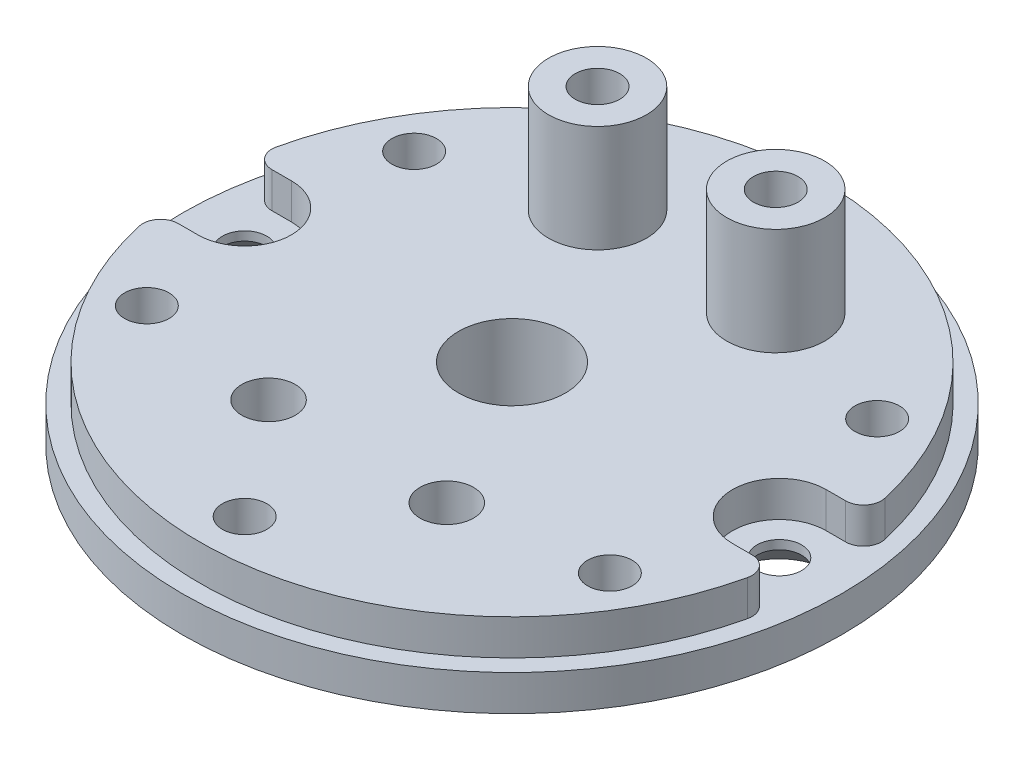
from build123d import *

# Parameters (mm, degrees)
SKETCH1_R            = 18.5
BOSS_EXTRUDE1_DEPTH  = 2
SKETCH2_R            = 17.5
BOSS_EXTRUDE2_DEPTH  = 2
SKETCH3_R            = 6
BOSS_EXTRUDE3_DEPTH  = 5
CUT_EXTRUDE1_REACH   = 29.668
SKETCH4_R            = 3
CUT_EXTRUDE4_DEPTH   = 2
FILLET1_R            = 1
CUT_EXTRUDE5_REACH   = 29.083
SKETCH6_R            = 1.25
FILLET1_OF_MIRROR1_R = 1
CHAMFER1_SIZE        = 1.5
CUT_EXTRUDE6_REACH   = 28.636
SKETCH7_R            = 1.25
CIRPATTERN1_COUNT    = 6
SKETCH9_R            = 1.5
CUT_EXTRUDE7_DEPTH   = 3.5
SKETCH10_R           = 2.75
BOSS_EXTRUDE4_DEPTH  = 6
SKETCH11_R           = 1.25
CUT_EXTRUDE8_DEPTH   = 6
FILLET2_R            = 0.25
CHAMFER2_SIZE        = 0.5
CUT_EXTRUDE9_DEPTH   = 0.3
CIRPATTERN2_COUNT    = 4
CHAMFER3_SIZE        = 0.25


with BuildPart() as part:
    # Sketch1 → Boss-Extrude1 (new body)
    with BuildSketch(Plane(origin=(0, 0, 0), x_dir=(1, 0, 0), z_dir=(0, 1, 0))):
        with Locations(Location((0, 0, 0), (0, 0, 270))):
            Circle(SKETCH1_R)
    extrude(amount=BOSS_EXTRUDE1_DEPTH)

    # Sketch2 → Boss-Extrude2 (add)
    with BuildSketch(Plane(origin=(0, 2, 0), x_dir=(1, 0, 0), z_dir=(0, 1, 0))):
        with Locations(Location((0, 0, 0), (0, 0, 270))):
            Circle(SKETCH2_R)
    extrude(amount=BOSS_EXTRUDE2_DEPTH)

    # Sketch3 → Boss-Extrude3 (add)
    with BuildSketch(Plane.XZ):
        with Locations(Location((0, 0, 0), (0, 0, 90))):
            Circle(SKETCH3_R)
    extrude(amount=BOSS_EXTRUDE3_DEPTH)

    # Sketch4 → Cut-Extrude1 (cut, up to next)
    with BuildSketch(Plane.XZ.offset(5), mode=Mode.PRIVATE) as cut_extrude1_sk1:
        with Locations(Location((0, 0, 0), (0, 0, 270))):
            Circle(SKETCH4_R)
    cut_extrude1_tool1 = extrude(cut_extrude1_sk1.sketch, amount=-CUT_EXTRUDE1_REACH, mode=Mode.PRIVATE) & part.part
    add(cut_extrude1_tool1.solids().sort_by_distance((0, -5, 0))[0], mode=Mode.SUBTRACT)

    # Sketch5 → Cut-Extrude4 (cut)
    with BuildSketch(Plane(origin=(0, 4, 0), x_dir=(1, 0, 0), z_dir=(0, 1, 0))):
        with BuildLine():
            Line((-17.625, 2.625), (-17.625, -2.625))
            Line((-17.625, -2.625), (-15, -2.625))
            ThreePointArc((-15, -2.625), (-12.375, 0), (-15, 2.625))
            Line((-15, 2.625), (-17.625, 2.625))
        make_face()
    cut_extrude4 = extrude(amount=-CUT_EXTRUDE4_DEPTH, mode=Mode.SUBTRACT)

    # Fillet1
    fillet1_edges = [part.edges().sort_by_distance(p)[0] for p in [
        (-17.302004942, 3, -2.625),
        (-17.302004942, 3, 2.625),
    ]]
    fillet(fillet1_edges, radius=FILLET1_R)

    # Sketch6 → Cut-Extrude5 (cut, up to next)
    with BuildSketch(Plane(origin=(0, 2, 0), x_dir=(1, 0, 0), z_dir=(0, 1, 0)), mode=Mode.PRIVATE) as cut_extrude5_sk1:
        with Locations(Location((-15, 0, 0), (0, 0, 270))):
            Circle(SKETCH6_R)
    cut_extrude5_tool1 = extrude(cut_extrude5_sk1.sketch, amount=-CUT_EXTRUDE5_REACH, mode=Mode.PRIVATE) & part.part
    cut_extrude5 = cut_extrude5_tool1.solids().sort_by_distance((-15, 2, 0))[0]
    add(cut_extrude5, mode=Mode.SUBTRACT)

    # Mirror1: Cut-Extrude4, Cut-Extrude5 across plane
    add(cut_extrude4.mirror(Plane(origin=(0, 0, 0), x_dir=(0, 0, 1), z_dir=(1, 0, 0))), mode=Mode.SUBTRACT)
    add(cut_extrude5.mirror(Plane(origin=(0, 0, 0), x_dir=(0, 0, 1), z_dir=(1, 0, 0))), mode=Mode.SUBTRACT)

    # Fillet1 of Mirror1
    fillet1_of_mirror1_edges = [part.edges().sort_by_distance(p)[0] for p in [
        (17.302004942, 3, -2.625),
        (17.302004942, 3, 2.625),
    ]]
    fillet(fillet1_of_mirror1_edges, radius=FILLET1_OF_MIRROR1_R)

    # Chamfer1
    chamfer1_edges = [part.edges().sort_by_distance(p)[0] for p in [
        (-15, 0, -1.25),
        (15, 0, -1.25),
    ]]
    chamfer(chamfer1_edges, length=CHAMFER1_SIZE)

    # Sketch7 → Cut-Extrude6 (cut, up to next)
    with BuildSketch(Plane.XZ, mode=Mode.PRIVATE) as cut_extrude6_sk1:
        with Locations(Location((0, 15, 0), (0, 0, 270))):
            Circle(SKETCH7_R)
    cut_extrude6_tool1 = extrude(cut_extrude6_sk1.sketch, amount=-CUT_EXTRUDE6_REACH, mode=Mode.PRIVATE) & part.part
    cut_extrude6 = cut_extrude6_tool1.solids().sort_by_distance((0, 0, 15))[0]
    add(cut_extrude6, mode=Mode.SUBTRACT)

    # CirPattern1: Cut-Extrude6 ×6 about axis
    cirpattern1_axis = Axis((0, 0, 0), (0, 1, 0))
    for i in range(1, CIRPATTERN1_COUNT):
        add(cut_extrude6.rotate(cirpattern1_axis, i * 360 / CIRPATTERN1_COUNT), mode=Mode.SUBTRACT)

    # Sketch9 → Cut-Extrude7 (cut)
    with BuildSketch(Plane(origin=(0, 4, 0), x_dir=(1, 0, 0), z_dir=(0, 1, 0))):
        with Locations(Location((-5, -8.660254038, 0), (0, 0, 270))):
            Circle(SKETCH9_R)
        with Locations(Location((5, -8.660254038, 0), (0, 0, 270))):
            Circle(SKETCH9_R)
    extrude(amount=-CUT_EXTRUDE7_DEPTH, mode=Mode.SUBTRACT)

    # Sketch10 → Boss-Extrude4 (add)
    with BuildSketch(Plane(origin=(0, 4, 0), x_dir=(1, 0, 0), z_dir=(0, 1, 0))):
        with Locations(Location((-5, 9.797958971, 0), (0, 0, 270))):
            Circle(SKETCH10_R)
        with Locations(Location((5, 9.797958971, 0), (0, 0, 270))):
            Circle(SKETCH10_R)
    extrude(amount=BOSS_EXTRUDE4_DEPTH)

    # Sketch11 → Cut-Extrude8 (cut)
    with BuildSketch(Plane(origin=(0, 10, 0), x_dir=(1, 0, 0), z_dir=(0, 1, 0))):
        with Locations(Location((-5, 9.797958971, 0), (0, 0, 270))):
            Circle(SKETCH11_R)
        with Locations(Location((5, 9.797958971, 0), (0, 0, 270))):
            Circle(SKETCH11_R)
    extrude(amount=-CUT_EXTRUDE8_DEPTH, mode=Mode.SUBTRACT)

    # Fillet2
    fillet2_edges = [part.edges().sort_by_distance(p)[0] for p in [
        (0, 0, -6),
        (0, -5, -6),
    ]]
    fillet(fillet2_edges, radius=FILLET2_R)

    # Chamfer2
    chamfer2_edges = [part.edges().sort_by_distance(p)[0] for p in [
        (0, -5, 3),
    ]]
    chamfer(chamfer2_edges, length=CHAMFER2_SIZE)

    # Sketch12 → Cut-Extrude9 (cut)
    with BuildSketch(Plane.XZ):
        with BuildLine():
            Line((-11.736694594, 1.5), (-8.124038405, 1.5))
            ThreePointArc((-8.124038405, 1.5), (-7.529949879, 1.695600333), (-7.168269181, 2.205882353))
            ThreePointArc((-7.168269181, 2.205882353), (-5.303300859, 5.303300859), (-2.205882353, 7.168269181))
            ThreePointArc((-2.205882353, 7.168269181), (-1.695600333, 7.529949879), (-1.5, 8.124038405))
            Line((-1.5, 8.124038405), (-1.5, 11.736694594))
            ThreePointArc((-1.5, 11.736694594), (-1.87084713, 12.513976182), (-2.708333333, 12.714752477))
            ThreePointArc((-2.708333333, 12.714752477), (-9.192388155, 9.192388155), (-12.714752477, 2.708333333))
            ThreePointArc((-12.714752477, 2.708333333), (-12.513976182, 1.87084713), (-11.736694594, 1.5))
        make_face()
    cut_extrude9 = extrude(amount=-CUT_EXTRUDE9_DEPTH, mode=Mode.SUBTRACT)

    # CirPattern2: Cut-Extrude9 ×4 about axis
    cirpattern2_axis = Axis((0, 0, 0), (0, 1, 0))
    for i in range(1, CIRPATTERN2_COUNT):
        add(cut_extrude9.rotate(cirpattern2_axis, i * 360 / CIRPATTERN2_COUNT), mode=Mode.SUBTRACT)

    # Chamfer3
    chamfer3_edges = [part.edges().sort_by_distance(p)[0] for p in [
        (0, 0, 16.25),
        (14.072912811, 0, 8.125),
        (14.072912811, 0, -8.125),
        (0, 0, -16.25),
        (-14.072912811, 0, -8.125),
        (-14.072912811, 0, 8.125),
    ]]
    chamfer(chamfer3_edges, length=CHAMFER3_SIZE)


solid = part.part
